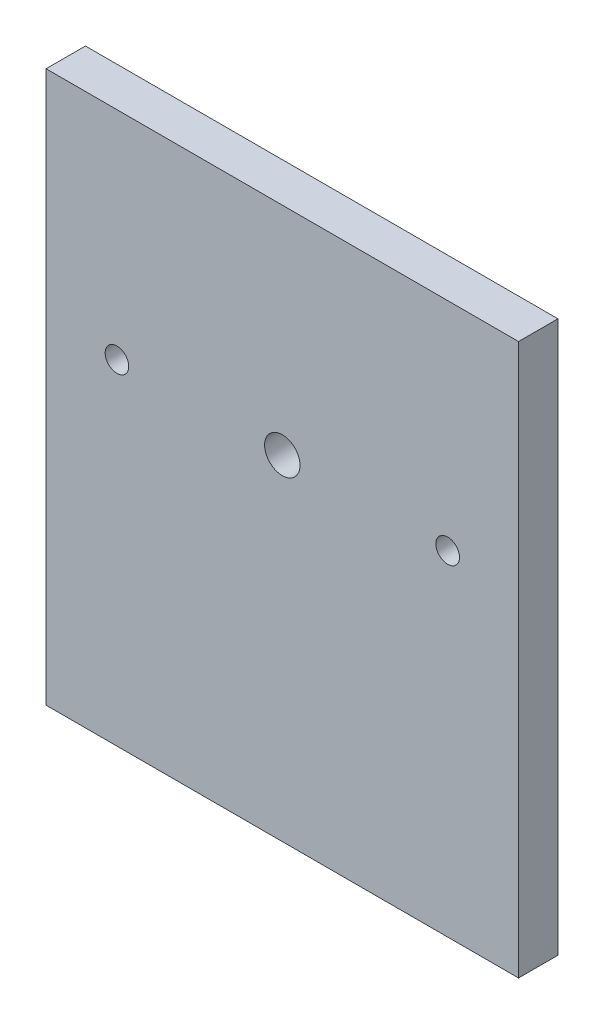
from build123d import *

# Parameters (mm, degrees)
SKETCH1_W           = 120
SKETCH1_H           = 140
SKETCH1_R           = 4.5
SKETCH1_R_2         = 3
BOSS_EXTRUDE1_DEPTH = 10


with BuildPart() as part:
    # Sketch1 → Boss-Extrude1 (new body)
    with BuildSketch(Plane.XY):
        with Locations((-60, -70)):
            Rectangle(SKETCH1_W, SKETCH1_H)
        with Locations((-60, -55)):
            Circle(SKETCH1_R, mode=Mode.SUBTRACT)
        with Locations((-102, -55)):
            Circle(SKETCH1_R_2, mode=Mode.SUBTRACT)
        with Locations((-18, -55)):
            Circle(SKETCH1_R_2, mode=Mode.SUBTRACT)
    extrude(amount=BOSS_EXTRUDE1_DEPTH)


solid = part.part
